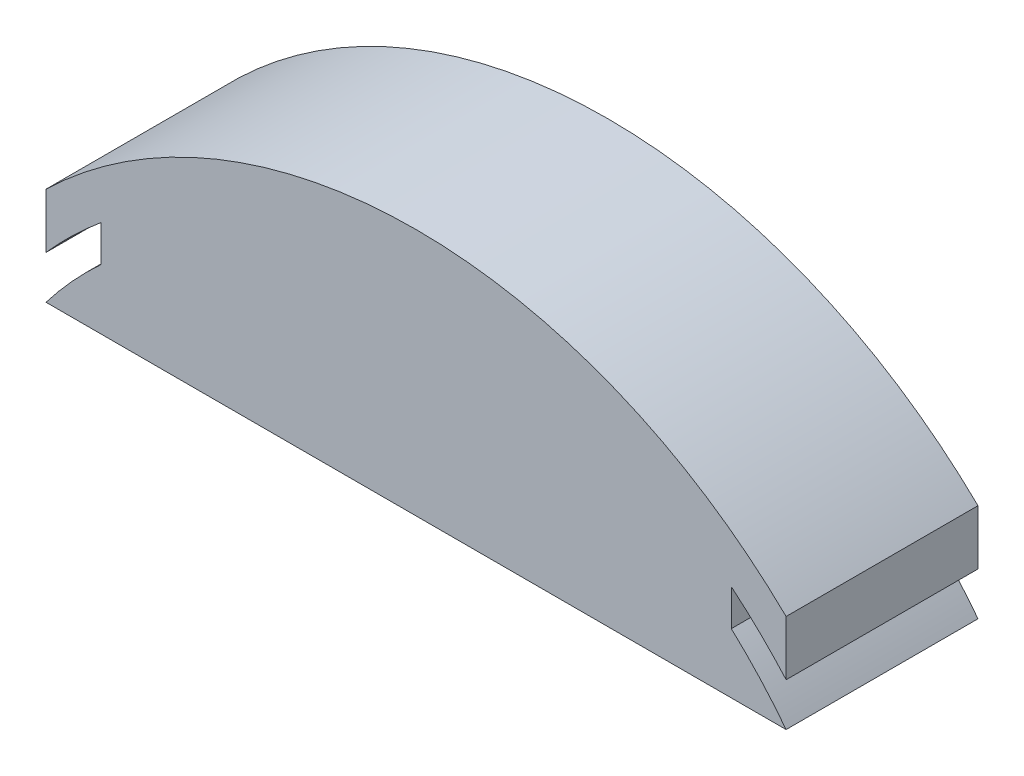
from build123d import *

# Parameters (mm, degrees)
BOSS_EXTRUDE6_DEPTH = 7


with BuildPart() as part:
    # Sketch1 → Boss-Extrude6 (new body)
    with BuildSketch(Plane.XY):
        with BuildLine():
            Line((0, 0), (27, 0))
            ThreePointArc((27, 0), (26.047781891, 1.137673852), (25, 2.187994866))
            Line((25, 2.187994866), (25, 3.515393264))
            ThreePointArc((25, 3.515393264), (26.037637618, 2.583414162), (27, 1.57389174))
            Line((27, 1.57389174), (27, 3.57389174))
            ThreePointArc((27, 3.57389174), (13.5, 9.049020195), (0, 3.57389174))
            Line((0, 3.57389174), (0, 1.57389174))
            ThreePointArc((0, 1.57389174), (0.962362382, 2.583414162), (2, 3.515393264))
            Line((2, 3.515393264), (2, 2.187994866))
            ThreePointArc((2, 2.187994866), (0.952218109, 1.137673852), (0, 0))
        make_face()
    extrude(amount=BOSS_EXTRUDE6_DEPTH)


solid = part.part
